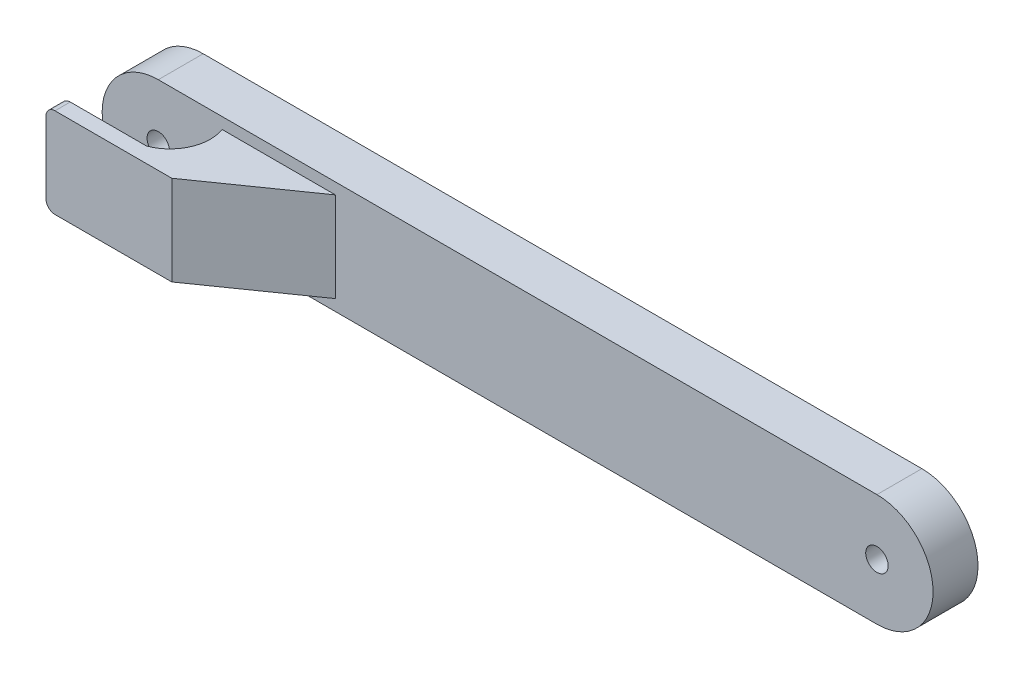
from build123d import *

# Parameters (mm, degrees)
SKETCH1_R           = 3.175
BOSS_EXTRUDE1_DEPTH = 12.7
BOSS_EXTRUDE8_DEPTH = 19.05
CUT_EXTRUDE3_DEPTH  = 41.148
BOSS_EXTRUDE9_DEPTH = 25.4


with BuildPart() as part:
    # Sketch1 → Boss-Extrude1 (new body)
    with BuildSketch(Plane.XY):
        with BuildLine():
            Line((299.870251741, -63.185614448), (503.070251741, -63.185614448))
            ThreePointArc((503.070251741, -63.185614448), (518.945251741, -79.060614448), (503.070251741, -94.935614448))
            Line((503.070251741, -94.935614448), (299.870251741, -94.935614448))
            ThreePointArc((299.870251741, -94.935614448), (283.995251741, -79.060614448), (299.870251741, -63.185614448))
        make_face()
        with Locations((299.870251741, -79.060614448)):
            Circle(SKETCH1_R, mode=Mode.SUBTRACT)
        with Locations((503.070251741, -79.060614448)):
            Circle(SKETCH1_R, mode=Mode.SUBTRACT)
    extrude(amount=BOSS_EXTRUDE1_DEPTH)

    # Sketch7 → Boss-Extrude8 (add)
    with BuildSketch(Plane.XY.offset(12.7)):
        with BuildLine():
            Line((310.030251741, -66.360614448), (312.570251741, -66.360614448))
            Line((312.570251741, -66.360614448), (322.730251741, -66.360614448))
            Line((322.730251741, -66.360614448), (322.730251741, -91.760614448))
            Line((322.730251741, -91.760614448), (310.030251741, -91.760614448))
            Line((310.030251741, -91.760614448), (289.710251741, -91.760614448))
            ThreePointArc((289.710251741, -91.760614448), (287.914200517, -91.016665672), (287.170251741, -89.220614448))
            Line((287.170251741, -89.220614448), (287.170251741, -68.900614448))
            ThreePointArc((287.170251741, -68.900614448), (287.914200517, -67.104563223), (289.710251741, -66.360614448))
            Line((289.710251741, -66.360614448), (310.030251741, -66.360614448))
        make_face()
    extrude(amount=BOSS_EXTRUDE8_DEPTH)

    # Sketch8 → Cut-Extrude3 (cut)
    with BuildSketch(Plane(origin=(0, -66.360614448, 0), x_dir=(1, 0, 0), z_dir=(0, 1, 0))):
        with BuildLine():
            Line((287.170251741, -12.7), (317.904251741, -12.7))
            ThreePointArc((317.904251741, -12.7), (317.648023156, -21.431345807), (311.300251741, -27.432))
            Line((311.300251741, -27.432), (287.170251741, -27.432))
            Line((287.170251741, -27.432), (287.170251741, -12.7))
        make_face()
    extrude(amount=-CUT_EXTRUDE3_DEPTH, mode=Mode.SUBTRACT)

    # Sketch9 → Boss-Extrude9 (add)
    with BuildSketch(Plane(origin=(0, -66.360614448, 0), x_dir=(1, 0, 0), z_dir=(0, 1, 0))):
        Polygon((322.730251741, -31.75), (349.936471269, -12.7), (322.730251741, -12.7), align=None)
    extrude(amount=-BOSS_EXTRUDE9_DEPTH)


solid = part.part
